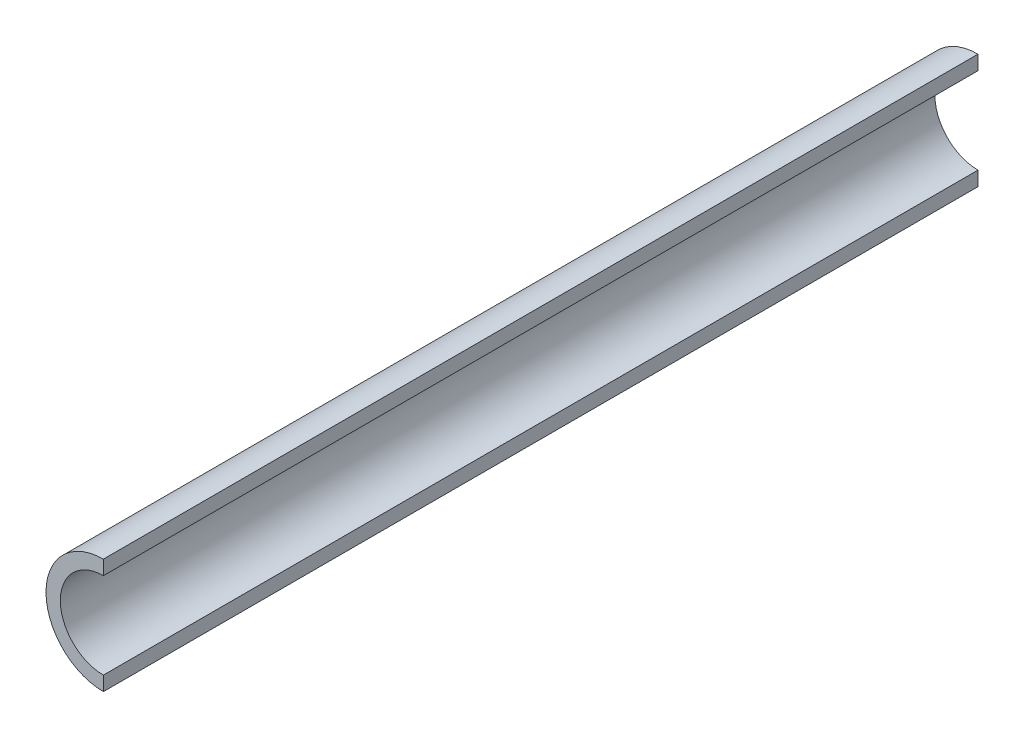
from build123d import *

# Parameters (mm, degrees)
BOSS_EXTRUDE3_DEPTH = 304.8


with BuildPart() as part:
    # Sketch3 → Boss-Extrude3 (new body)
    with BuildSketch(Plane(origin=(0, 0, 0), x_dir=(0, 1, 0), z_dir=(0, 0, 1))):
        with BuildLine():
            Line((0, 0), (5, 0))
            ThreePointArc((5, 0), (20, 15), (35, 0))
            Line((35, 0), (40, 0))
            ThreePointArc((40, 0), (20, 20), (0, 0))
        make_face()
    extrude(amount=BOSS_EXTRUDE3_DEPTH)


solid = part.part
